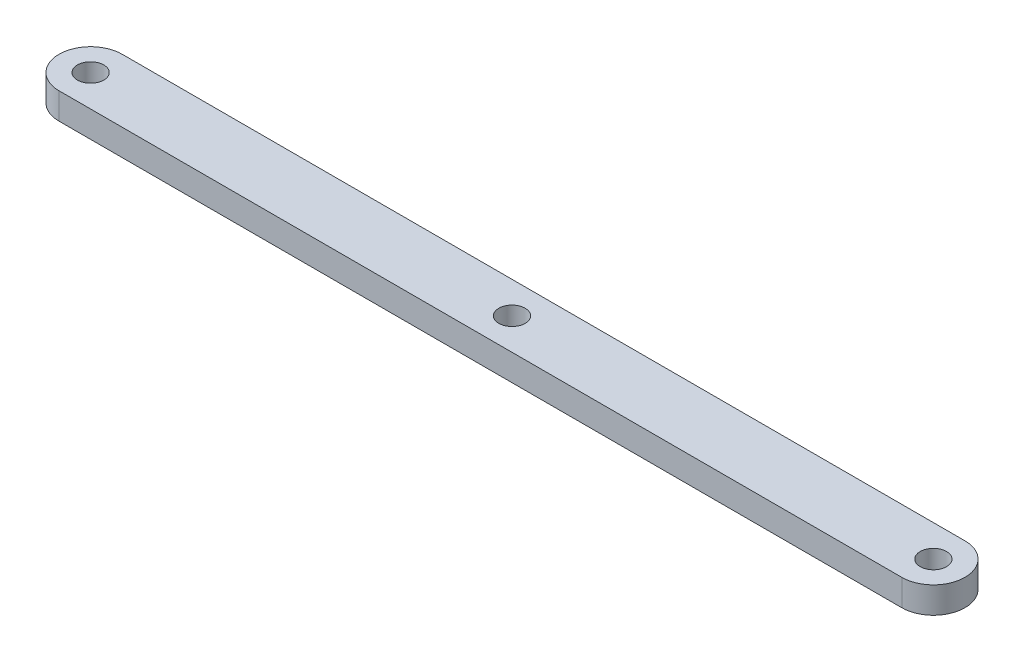
from build123d import *

# Parameters (mm, degrees)
BOSS_EXTRUDE1_DEPTH = 3.175
SKETCH4_R           = 1.5875
CUT_EXTRUDE1_DEPTH  = 55.834741041


with BuildPart() as part:
    # Sketch3 → Boss-Extrude1 (new body)
    with BuildSketch(Plane(origin=(0, 0, 0), x_dir=(1, 0, 0), z_dir=(0, 1, 0))):
        with BuildLine():
            Line((-50.8, 3.81), (50.8, 3.81))
            ThreePointArc((50.8, 3.81), (54.61, 0), (50.8, -3.81))
            Line((50.8, -3.81), (-50.8, -3.81))
            ThreePointArc((-50.8, -3.81), (-54.61, 0), (-50.8, 3.81))
        make_face()
    extrude(amount=BOSS_EXTRUDE1_DEPTH)

    # Sketch4 → Cut-Extrude1 (cut, through all)
    with BuildSketch(Plane(origin=(0, 3.175, 0), x_dir=(1, 0, 0), z_dir=(0, 1, 0))):
        with Locations(Location((-50.8, 0, 0), (0, 0, 270))):
            Circle(SKETCH4_R)
        with Locations(Location((0, 0, 0), (0, 0, 270))):
            Circle(SKETCH4_R)
        with Locations(Location((50.8, 0, 0), (0, 0, 270))):
            Circle(SKETCH4_R)
    extrude(amount=-CUT_EXTRUDE1_DEPTH, mode=Mode.SUBTRACT)


solid = part.part
